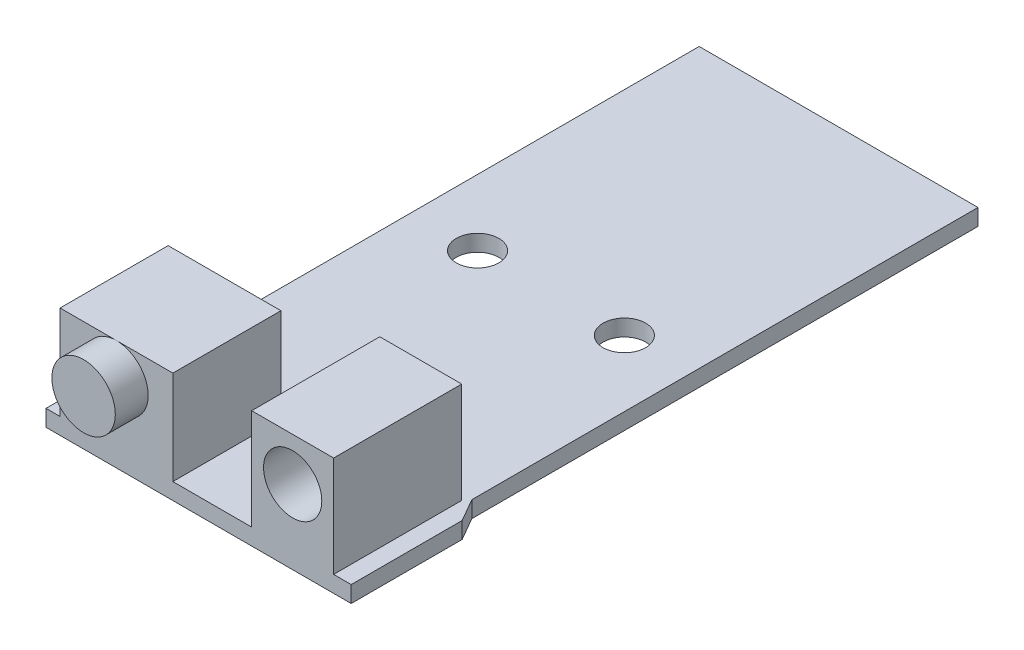
from build123d import *

# Parameters (mm, degrees)
BOSS_EXTRUDE1_DEPTH = 1.778
SKETCH2_W           = 8.86
SKETCH2_H           = 13.85
BOSS_EXTRUDE2_DEPTH = 10.9
SKETCH3_R           = 2.3
CUT_EXTRUDE1_DEPTH  = 72.970132694
SKETCH4_W           = 12.192
SKETCH4_H           = 11.684
BOSS_EXTRUDE3_DEPTH = 10.16
SKETCH5_R           = 3.429
BOSS_EXTRUDE4_DEPTH = 3.556
SKETCH6_R           = 3.1496
CUT_EXTRUDE2_DEPTH  = 11.656


with BuildPart() as part:
    # Sketch1 → Boss-Extrude1 (new body)
    with BuildSketch(Plane(origin=(0, 0, 0), x_dir=(1, 0, 0), z_dir=(0, 1, 0))):
        Polygon((-15.075, 69.2), (15.075, 69.2), (15.075, 14.468172401), (16.5, 12), (16.5, 0), (-16.5, 0), (-16.5, 12), (-15.075, 14.468172401), align=None)
    extrude(amount=BOSS_EXTRUDE1_DEPTH)

    # Sketch2 → Boss-Extrude2 (add)
    with BuildSketch(Plane(origin=(0, 1.778, 0), x_dir=(1, 0, 0), z_dir=(0, 1, 0))):
        with Locations((10.17, 6.925)):
            Rectangle(SKETCH2_W, SKETCH2_H)
    extrude(amount=BOSS_EXTRUDE2_DEPTH)

    # Sketch3 → Cut-Extrude1 (cut, through all)
    with BuildSketch(Plane(origin=(0, 1.778, 0), x_dir=(1, 0, 0), z_dir=(0, 1, 0))):
        with Locations(Location((-7.9375, 38.1, 0), (0, 0, 270))):
            Circle(SKETCH3_R)
        with Locations(Location((7.9375, 38.1, 0), (0, 0, 270))):
            Circle(SKETCH3_R)
    extrude(amount=-CUT_EXTRUDE1_DEPTH, mode=Mode.SUBTRACT)

    # Sketch4 → Boss-Extrude3 (add)
    with BuildSketch(Plane(origin=(0, 1.778, 0), x_dir=(1, 0, 0), z_dir=(0, 1, 0))):
        with Locations((-8.88, 5.842)):
            Rectangle(SKETCH4_W, SKETCH4_H)
    extrude(amount=BOSS_EXTRUDE3_DEPTH)

    # Sketch5 → Boss-Extrude4 (add)
    with BuildSketch(Plane.XY):
        with Locations(Location((-8.88, 8.509, 0), (0, 0, 90))):
            Circle(SKETCH5_R)
    extrude(amount=BOSS_EXTRUDE4_DEPTH)

    # Sketch6 → Cut-Extrude2 (cut)
    with BuildSketch(Plane.XY):
        with Locations((10.17, 8.0044)):
            Circle(SKETCH6_R)
    extrude(amount=-CUT_EXTRUDE2_DEPTH, mode=Mode.SUBTRACT)


solid = part.part
